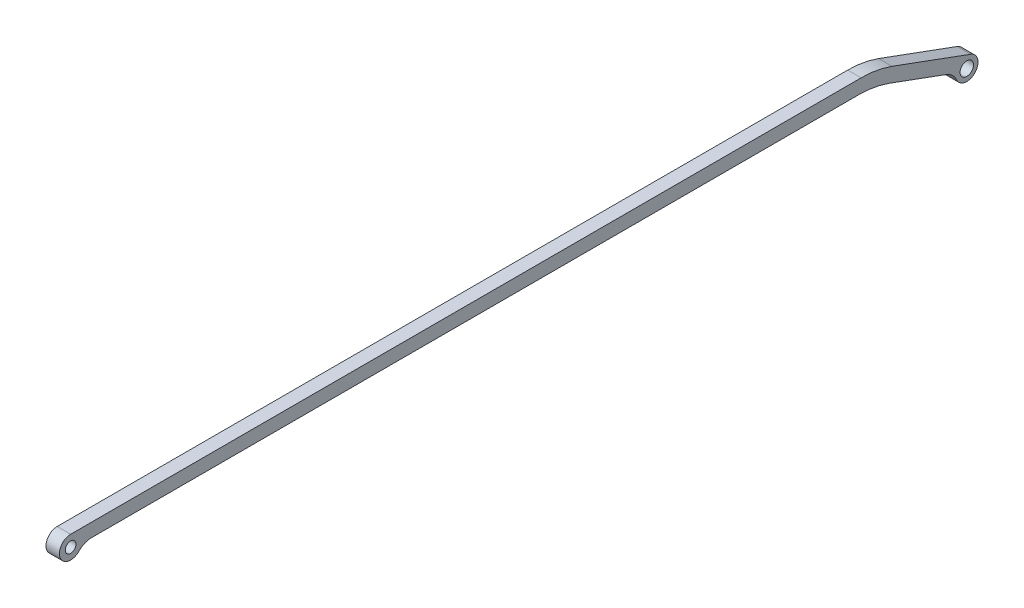
from build123d import *

# Parameters (mm, degrees)
SCHIZZO2_R                   = 0.6
SCHIZZO2_R_2                 = 0.75
ESTRUSIONE_ESTRUSIONE1_DEPTH = 1.5


with BuildPart() as part:
    # Schizzo2 → Estrusione-Estrusione1 (new body)
    with BuildSketch(Plane(origin=(0, 0, 0), x_dir=(0, 0, -1), z_dir=(1, 0, 0))):
        with BuildLine():
            Line((-8.332291626, 0.388194417), (0.430512151, -2.826475698))
            ThreePointArc((0.430512151, -2.826475698), (0.910624595, -4.856307682), (-1.144864856, -4.501781289))
            ThreePointArc((-1.144864856, -4.501781289), (-1.606556333, -3.847632001), (-2.287829183, -3.426992469))
            Line((-2.287829183, -3.426992469), (-8.598749951, -1.111805583))
            ThreePointArc((-8.598749951, -1.111805583), (-10.293839466, -0.654139343), (-12.04284716, -0.5))
            Line((-12.04284716, -0.5), (-97.584454883, -0.5))
            ThreePointArc((-97.584454883, -0.5), (-98.368919424, -0.660267578), (-99.027659733, -1.115384615))
            ThreePointArc((-99.027659733, -1.115384615), (-101.079495527, -0.740290338), (-99.929662763, 1))
            Line((-99.929662763, 1), (-11.776388835, 1))
            ThreePointArc((-11.776388835, 1), (-10.027381141, 0.845860657), (-8.332291626, 0.388194417))
        make_face()
        with Locations((-99.929662763, -0.25)):
            Circle(SCHIZZO2_R, mode=Mode.SUBTRACT)
        with Locations((0, -4)):
            Circle(SCHIZZO2_R_2, mode=Mode.SUBTRACT)
    extrude(amount=ESTRUSIONE_ESTRUSIONE1_DEPTH)


solid = part.part
